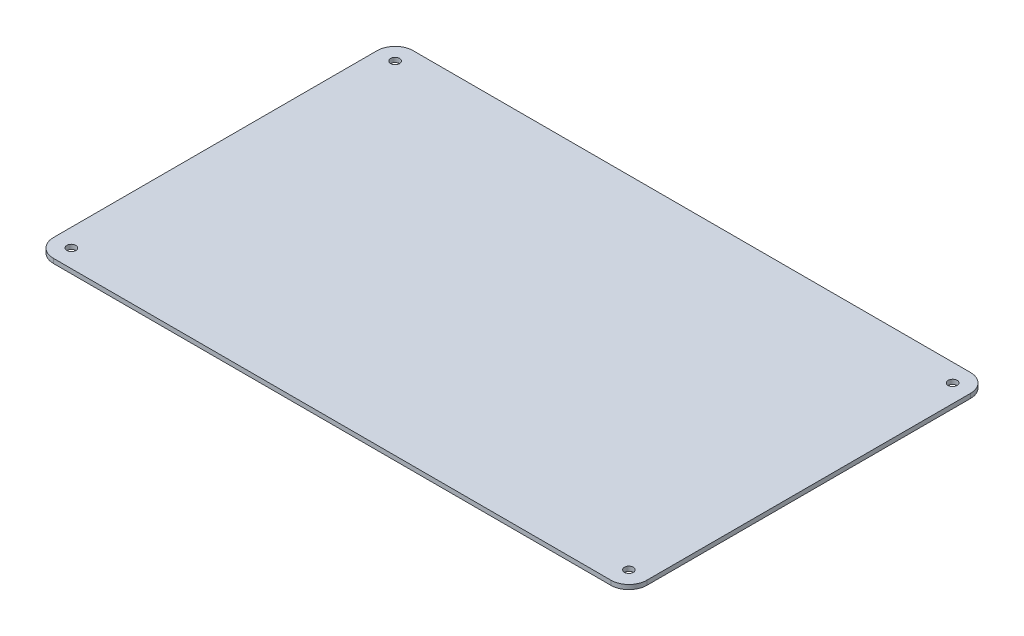
from build123d import *

# Parameters (mm, degrees)
SKETCH1_R           = 1.5875
BOSS_EXTRUDE1_DEPTH = 1.5875


with BuildPart() as part:
    # Sketch1 → Boss-Extrude1 (new body)
    with BuildSketch(Plane(origin=(0, 0, 0), x_dir=(1, 0, 0), z_dir=(0, 1, 0))):
        with BuildLine():
            Line((6.35, 0), (203.2, 0))
            ThreePointArc((203.2, 0), (207.690128061, 1.859871939), (209.55, 6.35))
            Line((209.55, 6.35), (209.55, 120.65))
            ThreePointArc((209.55, 120.65), (207.690128061, 125.140128061), (203.2, 127))
            Line((203.2, 127), (6.35, 127))
            ThreePointArc((6.35, 127), (1.859871939, 125.140128061), (0, 120.65))
            Line((0, 120.65), (0, 6.35))
            ThreePointArc((0, 6.35), (1.859871939, 1.859871939), (6.35, 0))
        make_face()
        with Locations(Location((6.35, 120.65, 0), (0, 0, 270))):
            Circle(SKETCH1_R, mode=Mode.SUBTRACT)
        with Locations(Location((203.2, 120.65, 0), (0, 0, 270))):
            Circle(SKETCH1_R, mode=Mode.SUBTRACT)
        with Locations(Location((203.2, 6.35, 0), (0, 0, 270))):
            Circle(SKETCH1_R, mode=Mode.SUBTRACT)
        with Locations(Location((6.35, 6.35, 0), (0, 0, 270))):
            Circle(SKETCH1_R, mode=Mode.SUBTRACT)
    extrude(amount=BOSS_EXTRUDE1_DEPTH)


solid = part.part
